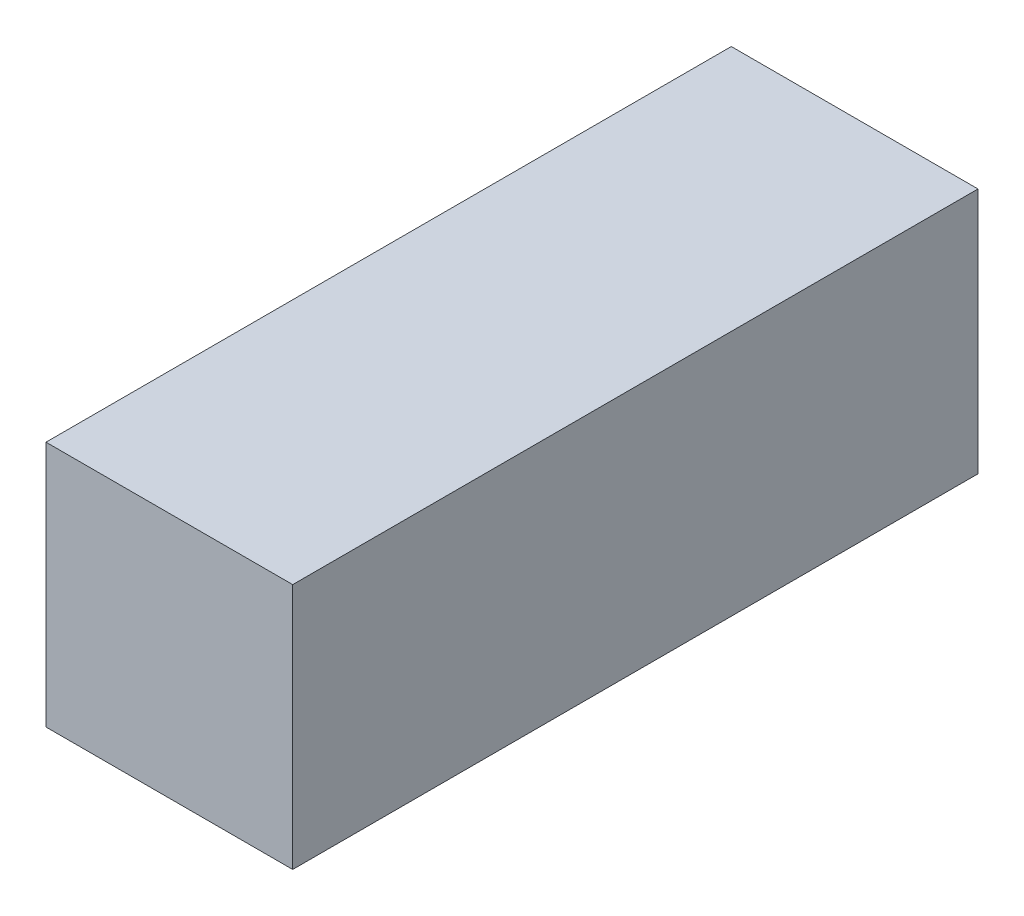
from build123d import *

# Parameters (mm, degrees)
SKETCH1_W           = 36
SKETCH1_H           = 36
BOSS_EXTRUDE1_DEPTH = 100


with BuildPart() as part:
    # Sketch1 → Boss-Extrude1 (new body)
    with BuildSketch(Plane.XY):
        Rectangle(SKETCH1_W, SKETCH1_H)
    extrude(amount=-BOSS_EXTRUDE1_DEPTH)


solid = part.part
